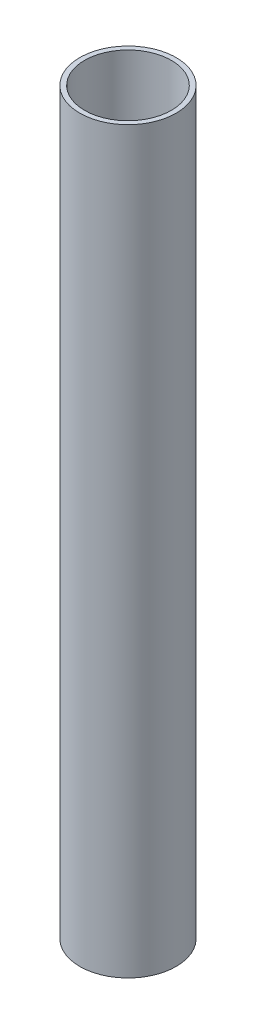
from build123d import *

# Parameters (mm, degrees)
SKETCH1_R           = 15
SKETCH1_R_2         = 13.5
BOSS_EXTRUDE1_DEPTH = 115


with BuildPart() as part:
    # Sketch1 → Boss-Extrude1 (new, symmetric)
    with BuildSketch(Plane(origin=(0, 0, 0), x_dir=(1, 0, 0), z_dir=(0, 1, 0))):
        with Locations(Location((0, 0, 0), (0, 0, 270))):
            Circle(SKETCH1_R)
        with Locations(Location((0, 0, 0), (0, 0, 270))):
            Circle(SKETCH1_R_2, mode=Mode.SUBTRACT)
    extrude(amount=BOSS_EXTRUDE1_DEPTH, both=True)


solid = part.part
